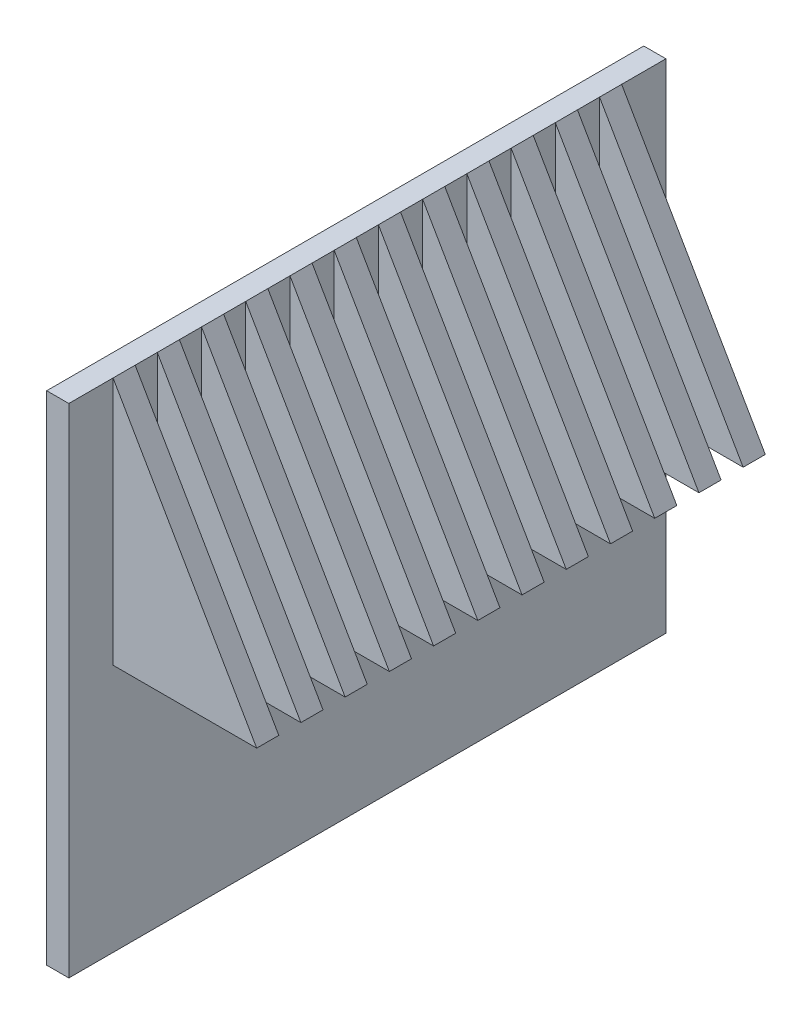
from build123d import *

# Parameters (mm, degrees)
SKETCH2_W           = 270
SKETCH2_H           = 225
BOSS_EXTRUDE1_DEPTH = 10
BOSS_EXTRUDE4_DEPTH = 270
SKETCH5_W           = 64.951905284
SKETCH5_H           = 10
CUT_EXTRUDE1_DEPTH  = 302.95039014


with BuildPart() as part:
    # Sketch2 → Boss-Extrude1 (new body)
    with BuildSketch(Plane(origin=(0, 0, 0), x_dir=(0, 0, -1), z_dir=(1, 0, 0))):
        with Locations((135, 112.5)):
            Rectangle(SKETCH2_W, SKETCH2_H)
    extrude(amount=BOSS_EXTRUDE1_DEPTH)

    # Sketch4 → Boss-Extrude4 (add)
    with BuildSketch(Plane.XY):
        Polygon((10, 225), (74.951905284, 112.5), (10, 112.5), align=None)
    extrude(amount=-BOSS_EXTRUDE4_DEPTH)

    # Sketch5 → Cut-Extrude1 (cut, through all)
    with BuildSketch(Plane.XZ.offset(-112.5)):
        with Locations((42.475952642, -265)):
            Rectangle(SKETCH5_W, SKETCH5_H)
        with Locations((42.475952642, -255)):
            Rectangle(SKETCH5_W, SKETCH5_H)
        with Locations((42.475952642, -235)):
            Rectangle(SKETCH5_W, SKETCH5_H)
        with Locations((42.475952642, -215)):
            Rectangle(SKETCH5_W, SKETCH5_H)
        with Locations((42.475952642, -195)):
            Rectangle(SKETCH5_W, SKETCH5_H)
        with Locations((42.475952642, -175)):
            Rectangle(SKETCH5_W, SKETCH5_H)
        with Locations((42.475952642, -155)):
            Rectangle(SKETCH5_W, SKETCH5_H)
        with Locations((42.475952642, -135)):
            Rectangle(SKETCH5_W, SKETCH5_H)
        with Locations((42.475952642, -115)):
            Rectangle(SKETCH5_W, SKETCH5_H)
        with Locations((42.475952642, -95)):
            Rectangle(SKETCH5_W, SKETCH5_H)
        with Locations((42.475952642, -75)):
            Rectangle(SKETCH5_W, SKETCH5_H)
        with Locations((42.475952642, -55)):
            Rectangle(SKETCH5_W, SKETCH5_H)
        with Locations((42.475952642, -35)):
            Rectangle(SKETCH5_W, SKETCH5_H)
        with Locations((42.475952642, -15)):
            Rectangle(SKETCH5_W, SKETCH5_H)
        with Locations((42.475952642, -5)):
            Rectangle(SKETCH5_W, SKETCH5_H)
    extrude(amount=-CUT_EXTRUDE1_DEPTH, mode=Mode.SUBTRACT)


solid = part.part
